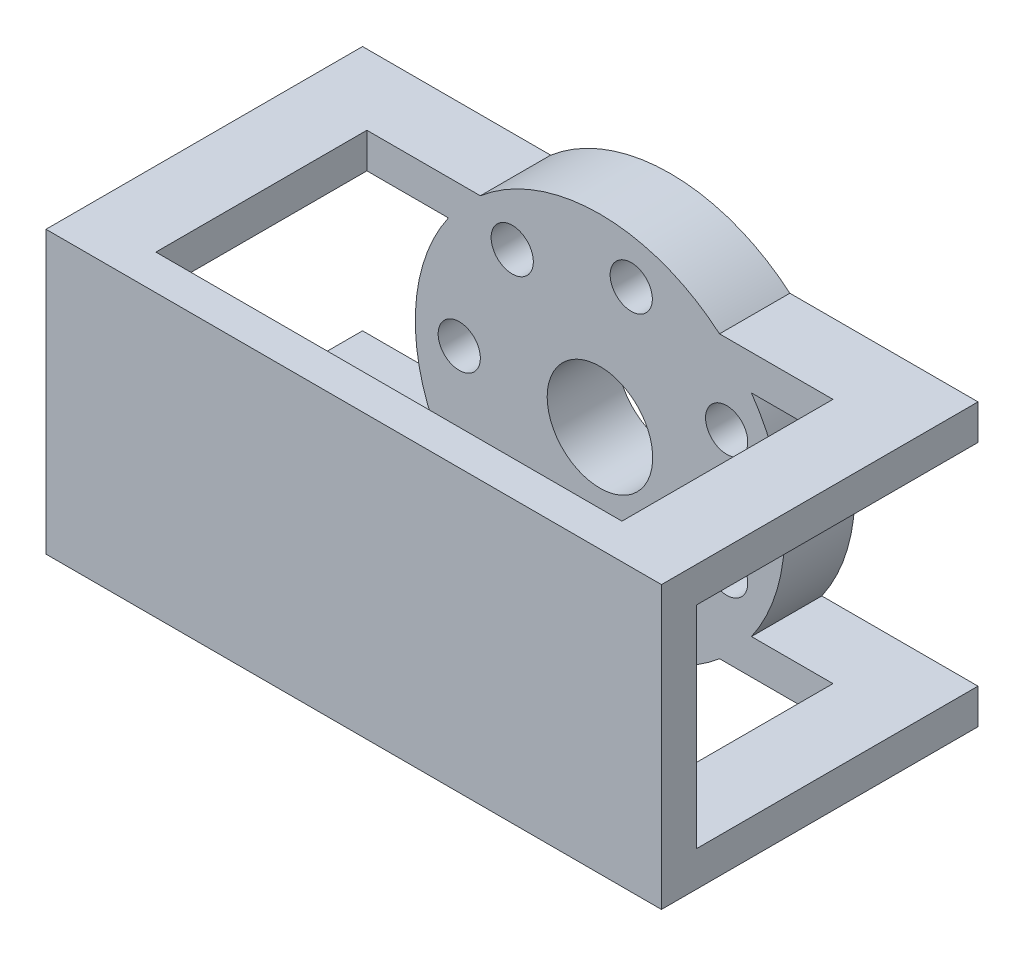
from build123d import *

# Parameters (mm, degrees)
SKETCH1_W               = 175
SKETCH1_H               = 90
BOSS_EXTRUDE1_DEPTH     = 80
CUT_EXTRUDE4_DEPTH      = 198.610728454
CUT_EXTRUDE4_DEPTH_BACK = 175
SKETCH5_W               = 132.519940576
SKETCH5_H               = 60
CUT_EXTRUDE5_DEPTH      = 175
BOSS_EXTRUDE2_DEPTH     = 20
SKETCH7_R               = 15
SKETCH7_R_2             = 6
CUT_EXTRUDE8_DEPTH      = 20


with BuildPart() as part:
    # Sketch1 → Boss-Extrude1 (new body)
    with BuildSketch(Plane(origin=(0, 0, 0), x_dir=(1, 0, 0), z_dir=(0, 1, 0))):
        Rectangle(SKETCH1_W, SKETCH1_H)
    extrude(amount=BOSS_EXTRUDE1_DEPTH)

    # Sketch4 → Cut-Extrude4 (cut, two sides: drawn at the far end of the back side and taken through both)
    with BuildSketch(Plane.ZY.offset(87.5).offset(-CUT_EXTRUDE4_DEPTH_BACK)):
        Polygon((35, 70), (-35, 70), (-45, 70), (-45, 10), (-35, 10), (35, 10), align=None)
    extrude(amount=CUT_EXTRUDE4_DEPTH + CUT_EXTRUDE4_DEPTH_BACK, mode=Mode.SUBTRACT)

    # Sketch5 → Cut-Extrude5 (cut)
    with BuildSketch(Plane(origin=(0, 80, 0), x_dir=(1, 0, 0), z_dir=(0, 1, 0))):
        with Locations((0, -5)):
            Rectangle(SKETCH5_W, SKETCH5_H)
    extrude(amount=-CUT_EXTRUDE5_DEPTH, mode=Mode.SUBTRACT)

    # Sketch6 → Boss-Extrude2 (add)
    with BuildSketch(Plane(origin=(0, 0, -45), x_dir=(-1, 0, 0), z_dir=(0, 0, -1))):
        with BuildLine():
            Line((-87.5, 0), (-34.003676272, 0))
            ThreePointArc((-34.003676272, 0), (0, -12.5), (34.003676272, 0))
            Line((34.003676272, 0), (87.5, 0))
            Line((87.5, 0), (87.5, 10))
            Line((87.5, 10), (43.084219849, 10))
            ThreePointArc((43.084219849, 10), (52.5, 40), (43.084219849, 70))
            Line((43.084219849, 70), (87.5, 70))
            Line((87.5, 70), (87.5, 80))
            Line((87.5, 80), (34.003676272, 80))
            ThreePointArc((34.003676272, 80), (0, 92.5), (-34.003676272, 80))
            Line((-34.003676272, 80), (-87.5, 80))
            Line((-87.5, 80), (-87.5, 70))
            Line((-87.5, 70), (-43.084219849, 70))
            ThreePointArc((-43.084219849, 70), (-52.5, 40), (-43.084219849, 10))
            Line((-43.084219849, 10), (-87.5, 10))
            Line((-87.5, 10), (-87.5, 0))
        make_face()
    extrude(amount=-BOSS_EXTRUDE2_DEPTH)

    # Sketch7 → Cut-Extrude8 (cut)
    with BuildSketch(Plane(origin=(0, 0, -45), x_dir=(-1, 0, 0), z_dir=(0, 0, -1))):
        with Locations((0, 40)):
            Circle(SKETCH7_R)
        with Locations((40, 40)):
            Circle(SKETCH7_R_2)
        with Locations((24.939592074, 8.726740701)):
            Circle(SKETCH7_R_2)
        with Locations((-8.900837358, 1.002883513)):
            Circle(SKETCH7_R_2)
        with Locations((-36.038754716, 22.644650435)):
            Circle(SKETCH7_R_2)
        with Locations((-36.038754716, 57.355349565)):
            Circle(SKETCH7_R_2)
        with Locations((-8.900837358, 78.997116487)):
            Circle(SKETCH7_R_2)
        with Locations((24.939592074, 71.273259299)):
            Circle(SKETCH7_R_2)
    extrude(amount=-CUT_EXTRUDE8_DEPTH, mode=Mode.SUBTRACT)


solid = part.part
